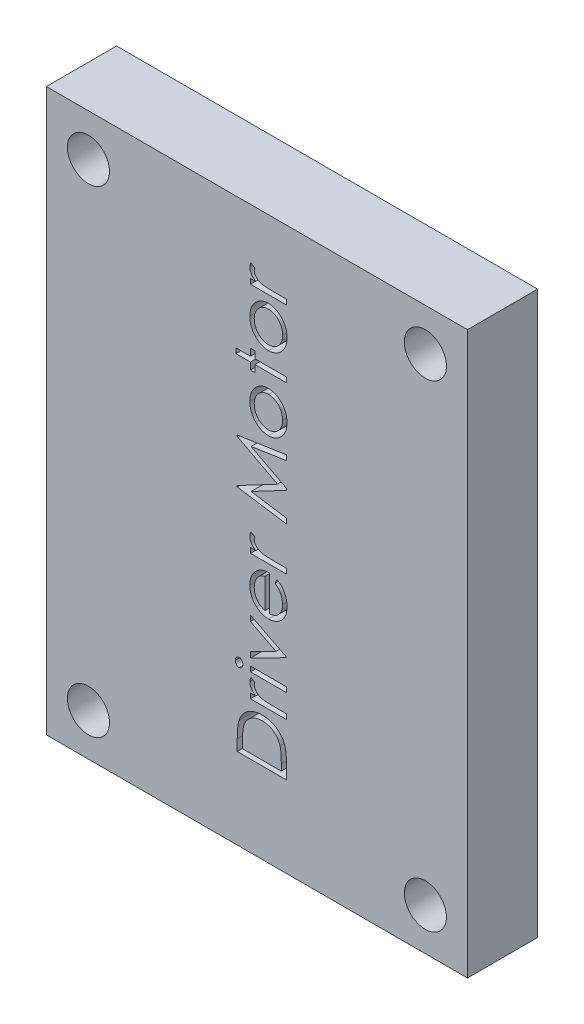
from build123d import *

# Parameters (mm, degrees)
ESQUISSE1_W             = 30
ESQUISSE1_H             = 40
EXTRUSION1_DEPTH        = 5
ESQUISSE2_W             = 2.557692308
ESQUISSE2_H             = 0.358974359
ENL_V_MAT_EXTRU_1_DEPTH = 2
ESQUISSE3_R             = 1.5
ENL_V_MAT_EXTRU_2_DEPTH = 8


with BuildPart() as part:
    # Esquisse1 → Extrusion1 (new body)
    with BuildSketch(Plane.XY):
        with Locations((-15, 20)):
            Rectangle(ESQUISSE1_W, ESQUISSE1_H)
    extrude(amount=EXTRUSION1_DEPTH)

    # Esquisse2 → Enlèv. mat.-Extru.1 (cut)
    # profile 1 of 12: a face of its own
    with BuildSketch(Plane.XY.offset(5)):
        with BuildLine():
            Line((-12.902097902, 5.772338772), (-16.402097902, 5.772338772))
            Line((-16.402097902, 5.772338772), (-16.402097902, 6.545676112))
            add(Edge.make_bspline(
                [(-16.402097902, 6.545676112), (-16.401656108, 6.612987478), (-16.400803038, 6.74296031), (-16.395379452, 6.930692141), (-16.385809041, 7.104193505), (-16.371780873, 7.263169427), (-16.354697847, 7.408027973), (-16.333195156, 7.538388127), (-16.307858741, 7.654644343), (-16.286139973, 7.726246699), (-16.275895979, 7.760019061)],
                knots=[0, 0, 0, 0, 1.318491949, 2.545901884, 3.678445365, 4.721642567, 5.671598565, 6.534823525, 7.308926774, 8, 8, 8, 8], degree=3))
            add(Edge.make_bspline(
                [(-16.275895979, 7.760019061), (-16.260459267, 7.80422512), (-16.229948056, 7.891599968), (-16.17272633, 8.016492431), (-16.107581186, 8.134124478), (-16.033451346, 8.243774374), (-15.952137973, 8.346445741), (-15.862505794, 8.441894398), (-15.764214035, 8.529329492), (-15.65830616, 8.60940729), (-15.54554016, 8.680542462), (-15.427436072, 8.74347772), (-15.303731586, 8.796020344), (-15.174696717, 8.838806109), (-15.040469539, 8.872658689), (-14.90074175, 8.896229135), (-14.755926812, 8.910463888), (-14.657739296, 8.912388187), (-14.607927229, 8.913364413)],
                knots=[0, 0, 0, 0, 1.03109956, 2.038004968, 3.022183136, 3.990379863, 4.950479215, 5.904790362, 6.871123431, 7.845270789, 8.826576108, 9.805447093, 10.790473371, 11.783660713, 12.797649702, 13.837096931, 14.902725355, 16, 16, 16, 16], degree=3))
            add(Edge.make_bspline(
                [(-14.607927229, 8.913364413), (-14.564660425, 8.912837926), (-14.47935704, 8.911799922), (-14.353652784, 8.899183842), (-14.23192668, 8.880312897), (-14.113849107, 8.854841807), (-13.999858263, 8.820102242), (-13.88984192, 8.777977415), (-13.78344577, 8.729034272), (-13.682264675, 8.671922173), (-13.585709979, 8.610091954), (-13.495564454, 8.542500347), (-13.412405212, 8.470096275), (-13.334311013, 8.394269346), (-13.26399848, 8.312984237), (-13.199605963, 8.227617645), (-13.141873115, 8.137774685), (-13.091109647, 8.041968675), (-13.045625918, 7.93960376), (-13.007269223, 7.827840497), (-12.974443614, 7.706760419), (-12.948183208, 7.575763501), (-12.927024454, 7.435399529), (-12.912890228, 7.285123066), (-12.903371034, 7.125159817), (-12.902530418, 7.015209003), (-12.902097902, 6.958636849)],
                knots=[0, 0, 0, 0, 1.054918746, 2.079842537, 3.077911686, 4.058492111, 5.023238441, 5.981293042, 6.930009524, 7.876754672, 8.812782874, 9.724811993, 10.621934444, 11.500650362, 12.377385791, 13.240394098, 14.10689676, 14.979024605, 15.882480973, 16.83611648, 17.857992353, 18.940126528, 20.092916994, 21.318615187, 22.620367535, 24, 24, 24, 24], degree=3))
            Line((-12.902097902, 6.958636849), (-12.902097902, 5.772338772))
        make_face()
        with BuildLine():
            Line((-13.261072261, 6.131313131), (-13.261072261, 6.565307522))
            add(Edge.make_bspline(
                [(-13.261072261, 6.565307522), (-13.261320821, 6.627709783), (-13.261798452, 6.747621747), (-13.265968691, 6.919898303), (-13.272871921, 7.07745616), (-13.282354499, 7.220094338), (-13.295025627, 7.347733672), (-13.30929795, 7.460575796), (-13.326727963, 7.558599252), (-13.342736088, 7.618244065), (-13.350114729, 7.645736208)],
                knots=[0, 0, 0, 0, 1.377932993, 2.64783117, 3.804968788, 4.860218214, 5.80403942, 6.636825548, 7.371670635, 8, 8, 8, 8], degree=3))
            add(Edge.make_bspline(
                [(-13.350114729, 7.645736208), (-13.361345195, 7.680250608), (-13.383469415, 7.748244597), (-13.42412104, 7.846295386), (-13.472222024, 7.938014285), (-13.525092097, 8.024998267), (-13.586221852, 8.105084148), (-13.652486699, 8.180154587), (-13.725533766, 8.249479138), (-13.804251649, 8.3128753), (-13.888488656, 8.369990696), (-13.978096839, 8.419081513), (-14.072059408, 8.461197397), (-14.170468628, 8.495826178), (-14.273626761, 8.521520667), (-14.381167101, 8.540262334), (-14.493347945, 8.552832649), (-14.56979825, 8.553865471), (-14.608628351, 8.554390054)],
                knots=[0, 0, 0, 0, 1.039856125, 2.048535285, 3.037002883, 4.00530023, 4.961642974, 5.919906605, 6.872042732, 7.843692398, 8.813285808, 9.784450683, 10.76770926, 11.761065139, 12.769744298, 13.810225642, 14.887785225, 16, 16, 16, 16], degree=3))
            add(Edge.make_bspline(
                [(-14.608628351, 8.554390054), (-14.649551403, 8.553526159), (-14.729938021, 8.551829177), (-14.848184486, 8.540125194), (-14.961518376, 8.518734132), (-15.070475296, 8.489935986), (-15.175501003, 8.45395534), (-15.27519799, 8.407632058), (-15.371049436, 8.354635654), (-15.461224704, 8.292624274), (-15.546327507, 8.224196942), (-15.624269217, 8.148169159), (-15.695241912, 8.065602233), (-15.760180143, 7.977395185), (-15.816756848, 7.881880116), (-15.867807311, 7.780802222), (-15.910401721, 7.672361029), (-15.933321199, 7.597058178), (-15.944966492, 7.558797106)],
                knots=[0, 0, 0, 0, 1.089998388, 2.141122879, 3.160582858, 4.158627459, 5.140999449, 6.113141423, 7.082948792, 8.055011043, 9.024278859, 9.98833552, 10.950481064, 11.921645981, 12.901668197, 13.903858501, 14.93495903, 16, 16, 16, 16], degree=3))
            add(Edge.make_bspline(
                [(-15.944966492, 7.558797106), (-15.953091171, 7.527103365), (-15.970417258, 7.459515651), (-15.989120715, 7.349503315), (-16.00581549, 7.225561123), (-16.019802353, 7.087374239), (-16.029934862, 6.93489675), (-16.037475102, 6.768225447), (-16.042593234, 6.587307664), (-16.04294245, 6.462012678), (-16.043123543, 6.397038292)],
                knots=[0, 0, 0, 0, 0.671630374, 1.43226897, 2.289500064, 3.239801583, 4.283712342, 5.427140445, 6.66578882, 8, 8, 8, 8], degree=3))
            Line((-16.043123543, 6.397038292), (-16.043123543, 6.131313131))
            Line((-16.043123543, 6.131313131), (-13.261072261, 6.131313131))
        make_face(mode=Mode.SUBTRACT)
    # profile 2 of 12: a face of its own
    with BuildSketch(Plane.XY.offset(5)):
        with BuildLine():
            Line((-15.45979021, 9.496697747), (-15.45979021, 9.855672106))
            Line((-15.45979021, 9.855672106), (-15.083287806, 9.855672106))
            add(Edge.make_bspline(
                [(-15.083287806, 9.855672106), (-15.118385216, 9.881201059), (-15.185741338, 9.93019417), (-15.274868065, 10.011234171), (-15.348324495, 10.094718562), (-15.406861233, 10.18042667), (-15.450801501, 10.268331559), (-15.481881348, 10.35787403), (-15.500894177, 10.449424748), (-15.503403804, 10.511132952), (-15.504662005, 10.542070343)],
                knots=[0, 0, 0, 0, 1.240090001, 2.379880825, 3.435825918, 4.412439249, 5.338731203, 6.236759833, 7.116000016, 8, 8, 8, 8], degree=3))
            add(Edge.make_bspline(
                [(-15.504662005, 10.542070343), (-15.503464336, 10.565990505), (-15.50099697, 10.615269439), (-15.483918986, 10.689996016), (-15.456529453, 10.767057654), (-15.430515759, 10.816963918), (-15.41702178, 10.842851593)],
                knots=[0, 0, 0, 0, 0.906785846, 1.868107758, 2.894132143, 4, 4, 4, 4], degree=3))
            Line((-15.41702178, 10.842851593), (-15.144986524, 10.655652074))
            add(Edge.make_bspline(
                [(-15.144986524, 10.655652074), (-15.151720046, 10.638897443), (-15.16449045, 10.607121589), (-15.179763804, 10.560751378), (-15.188559994, 10.518099649), (-15.189924319, 10.490920638), (-15.190559441, 10.47826826)],
                knots=[0, 0, 0, 0, 1.175706723, 2.229776724, 3.175925307, 4, 4, 4, 4], degree=3))
            add(Edge.make_bspline(
                [(-15.190559441, 10.47826826), (-15.188906274, 10.450500016), (-15.185546911, 10.394072801), (-15.158539935, 10.311215918), (-15.116436175, 10.229800735), (-15.067517162, 10.165956602), (-15.021258441, 10.116025177), (-14.979750811, 10.081136701), (-14.934840231, 10.047264877), (-14.884146785, 10.017592566), (-14.83020237, 9.988072235), (-14.770472733, 9.962862403), (-14.706685693, 9.938763003), (-14.662229579, 9.925076474), (-14.63947771, 9.918071945)],
                knots=[0, 0, 0, 0, 1.183164879, 2.404282402, 3.684748724, 5.08130077, 5.822236575, 6.586118212, 7.392150472, 8.220166419, 9.090371106, 10.015126268, 10.984176003, 12, 12, 12, 12], degree=3))
            add(Edge.make_bspline(
                [(-14.63947771, 9.918071945), (-14.619209963, 9.912860351), (-14.574147304, 9.901273058), (-14.498775917, 9.889673791), (-14.409659452, 9.879301238), (-14.307049868, 9.870034959), (-14.190095992, 9.864333236), (-14.05967858, 9.859517499), (-13.915241141, 9.855617649), (-13.814493976, 9.855653375), (-13.761673223, 9.855672106)],
                knots=[0, 0, 0, 0, 0.569198417, 1.265537535, 2.072538121, 3.011085978, 4.068372936, 5.258499352, 6.562658, 8, 8, 8, 8], degree=3))
            Line((-13.761673223, 9.855672106), (-12.902097902, 9.855672106))
            Line((-12.902097902, 9.855672106), (-12.902097902, 9.496697747))
            Line((-12.902097902, 9.496697747), (-15.45979021, 9.496697747))
        make_face()
    # profile 3 of 12: a face of its own
    with BuildSketch(Plane.XY.offset(5)):
        with BuildLine():
            add(Edge.make_bspline(
                [(-16.536713287, 11.335039093), (-16.535814731, 11.356157736), (-16.53406397, 11.397305681), (-16.519062593, 11.456696549), (-16.493239576, 11.510613355), (-16.458996631, 11.558628922), (-16.418454057, 11.599726284), (-16.371169809, 11.628702912), (-16.320066766, 11.647719112), (-16.284243261, 11.64959354), (-16.266080274, 11.650543901)],
                knots=[0, 0, 0, 0, 1.097978545, 2.139321259, 3.162173311, 4.19151332, 5.197815518, 6.142860071, 7.058405672, 8, 8, 8, 8], degree=3))
            add(Edge.make_bspline(
                [(-16.266080274, 11.650543901), (-16.248388248, 11.649567479), (-16.213261071, 11.647628812), (-16.163042103, 11.62871047), (-16.116432734, 11.599491456), (-16.075950842, 11.55865518), (-16.041730171, 11.51060631), (-16.015901165, 11.456698457), (-16.000901407, 11.39730517), (-15.99915042, 11.356157562), (-15.998251748, 11.335039093)],
                knots=[0, 0, 0, 0, 0.922703544, 1.832010186, 2.772146749, 3.784264281, 4.819552758, 5.848315786, 6.89567633, 8, 8, 8, 8], degree=3))
            add(Edge.make_bspline(
                [(-15.998251748, 11.335039093), (-15.999133795, 11.314379521), (-16.000851926, 11.274136913), (-16.016188716, 11.215795576), (-16.041705596, 11.162270406), (-16.075957296, 11.114229058), (-16.116431155, 11.073390834), (-16.163042496, 11.044172298), (-16.213260972, 11.025253837), (-16.248388215, 11.023315186), (-16.266080274, 11.022338772)],
                knots=[0, 0, 0, 0, 1.086463775, 2.116313756, 3.151298715, 4.192848589, 5.211087382, 6.156909866, 7.071715969, 8, 8, 8, 8], degree=3))
            add(Edge.make_bspline(
                [(-16.266080274, 11.022338772), (-16.284243296, 11.023289124), (-16.320066868, 11.025163537), (-16.371169409, 11.044179858), (-16.418455655, 11.073156002), (-16.458990178, 11.114255316), (-16.493264154, 11.162263354), (-16.518775074, 11.215797437), (-16.53411344, 11.274136419), (-16.535831352, 11.314379353), (-16.536713287, 11.335039093)],
                knots=[0, 0, 0, 0, 0.947256149, 1.868306938, 2.819034057, 3.831387165, 4.86691661, 5.895919087, 6.919816268, 8, 8, 8, 8], degree=3))
        make_face()
    # profile 4 of 12: a face of its own
    with BuildSketch(Plane.XY.offset(5)):
        with Locations((-14.180944056, 11.336441337)):
            Rectangle(ESQUISSE2_W, ESQUISSE2_H)
    # profile 5 of 12: a face of its own
    with BuildSketch(Plane.XY.offset(5)):
        Polygon((-15.45979021, 12.00951826), (-15.45979021, 12.406353195), (-13.637574665, 13.33393733), (-15.45979021, 14.260119221), (-15.45979021, 14.656954157), (-12.902097902, 13.355672106), (-12.902097902, 13.310800311), align=None)
    # profile 6 of 12: a face of its own
    with BuildSketch(Plane.XY.offset(5)):
        with BuildLine():
            Line((-13.70979021, 17.495796304), (-13.563255755, 17.797979798))
            add(Edge.make_bspline(
                [(-13.563255755, 17.797979798), (-13.523717481, 17.773479033), (-13.446359663, 17.725542551), (-13.341431214, 17.642741642), (-13.246890758, 17.555876573), (-13.165433554, 17.461541662), (-13.093350727, 17.362473318), (-13.031547364, 17.256995228), (-12.977773836, 17.14614058), (-12.934492278, 17.028350135), (-12.899975546, 16.904095052), (-12.874578352, 16.772402818), (-12.859937239, 16.632582055), (-12.858144403, 16.536696175), (-12.857226107, 16.487583163)],
                knots=[0, 0, 0, 0, 1.069570816, 2.092647344, 3.070569067, 4.01967349, 4.95558248, 5.886223065, 6.829136365, 7.787158173, 8.769682878, 9.793833117, 10.86999526, 12, 12, 12, 12], degree=3))
            add(Edge.make_bspline(
                [(-12.857226107, 16.487583163), (-12.858355988, 16.433069067), (-12.860555103, 16.326966929), (-12.880007871, 16.172344769), (-12.911002951, 16.026876038), (-12.955556286, 15.890408962), (-13.012089363, 15.762923892), (-13.082388469, 15.644884658), (-13.164393611, 15.535523591), (-13.259256009, 15.437531251), (-13.36130213, 15.349973357), (-13.466929484, 15.272058257), (-13.577067727, 15.207677693), (-13.689779887, 15.153478007), (-13.806235341, 15.112285446), (-13.925988713, 15.082766341), (-14.048747968, 15.063615254), (-14.132028539, 15.061742583), (-14.173932838, 15.060800311)],
                knots=[0, 0, 0, 0, 1.205476757, 2.346249306, 3.441406768, 4.491003892, 5.516176455, 6.51984946, 7.52384197, 8.53303875, 9.530058913, 10.495883174, 11.432185487, 12.347937671, 13.258729326, 14.159013425, 15.073670464, 16, 16, 16, 16], degree=3))
            add(Edge.make_bspline(
                [(-14.173932838, 15.060800311), (-14.213250113, 15.061661851), (-14.291258766, 15.063371217), (-14.406429852, 15.079530548), (-14.518728895, 15.104510617), (-14.627502264, 15.140629995), (-14.733361704, 15.186136051), (-14.835180062, 15.243051897), (-14.934824897, 15.308554135), (-14.996585215, 15.36002424), (-15.027899184, 15.386120824)],
                knots=[0, 0, 0, 0, 1.009393624, 2.002718548, 2.981368972, 3.96092115, 4.942292709, 5.936433579, 6.953722102, 8, 8, 8, 8], degree=3))
            add(Edge.make_bspline(
                [(-15.027899184, 15.386120824), (-15.065894525, 15.421057633), (-15.140928548, 15.490051599), (-15.238080685, 15.607061837), (-15.320768429, 15.732559213), (-15.388421509, 15.867112263), (-15.440370322, 16.010537372), (-15.477439414, 16.162371088), (-15.50031742, 16.322826832), (-15.503193399, 16.432818591), (-15.504662005, 16.488985407)],
                knots=[0, 0, 0, 0, 0.997027178, 1.968950865, 2.931417886, 3.897315191, 4.873598335, 5.874141366, 6.914439499, 8, 8, 8, 8], degree=3))
            add(Edge.make_bspline(
                [(-15.504662005, 16.488985407), (-15.503316152, 16.546801876), (-15.50067778, 16.660143625), (-15.475999728, 16.825483776), (-15.437339428, 16.982309424), (-15.381193875, 17.129434337), (-15.311243898, 17.268527668), (-15.222924733, 17.397087153), (-15.120735915, 17.518308081), (-15.041418315, 17.589471084), (-15.001256556, 17.625503836)],
                knots=[0, 0, 0, 0, 1.078704368, 2.114661124, 3.113565113, 4.088377923, 5.048374518, 6.012812246, 6.993805198, 8, 8, 8, 8], degree=3))
            add(Edge.make_bspline(
                [(-15.001256556, 17.625503836), (-14.971065715, 17.649686965), (-14.911002384, 17.697798221), (-14.813245302, 17.759718894), (-14.71023322, 17.812369237), (-14.601439801, 17.855246842), (-14.487405531, 17.888982005), (-14.367768757, 17.913270093), (-14.242600787, 17.929270077), (-14.157155727, 17.931473117), (-14.113636364, 17.932595183)],
                knots=[0, 0, 0, 0, 0.967473567, 1.924745518, 2.889953502, 3.858752097, 4.846970718, 5.862117206, 6.911121386, 8, 8, 8, 8], degree=3))
            Line((-14.113636364, 17.932595183), (-14.113636364, 15.41977467))
            add(Edge.make_bspline(
                [(-14.113636364, 15.41977467), (-14.07993253, 15.421519361), (-14.013599904, 15.424953094), (-13.9164045, 15.440204421), (-13.8242357, 15.465796277), (-13.736782614, 15.499462949), (-13.653993167, 15.541895321), (-13.575826406, 15.593224971), (-13.502560053, 15.654199611), (-13.434475016, 15.723007189), (-13.37285665, 15.798711609), (-13.318954012, 15.879266324), (-13.272748155, 15.964055202), (-13.23568408, 16.053418364), (-13.20675572, 16.147083802), (-13.186732052, 16.245260095), (-13.173626859, 16.347473005), (-13.172101577, 16.417196253), (-13.171328671, 16.452527074)],
                knots=[0, 0, 0, 0, 1.039073669, 2.045004336, 3.02296125, 3.980111893, 4.926619486, 5.882957722, 6.854402205, 7.857159866, 8.859995037, 9.85624635, 10.83864398, 11.829261994, 12.831114931, 13.853244543, 14.912175862, 16, 16, 16, 16], degree=3))
            add(Edge.make_bspline(
                [(-13.171328671, 16.452527074), (-13.171955179, 16.48714568), (-13.173207279, 16.556332337), (-13.184789305, 16.659233202), (-13.203636298, 16.760744844), (-13.230469627, 16.859395566), (-13.262061876, 16.953957854), (-13.299150804, 17.041968311), (-13.341426078, 17.122383892), (-13.389530688, 17.197756028), (-13.448361388, 17.270742481), (-13.521395633, 17.344108247), (-13.609339909, 17.420630103), (-13.675086186, 17.469827546), (-13.70979021, 17.495796304)],
                knots=[0, 0, 0, 0, 1.015927462, 2.030371344, 3.035493238, 4.043957638, 5.028905753, 5.960363326, 6.844165366, 7.692896148, 8.581107265, 9.590178204, 10.727981024, 12, 12, 12, 12], degree=3))
        make_face()
        with BuildLine():
            add(Edge.make_bspline(
                [(-14.427738928, 17.573620824), (-14.469437539, 17.560982139), (-14.549619428, 17.536679323), (-14.660766036, 17.486598255), (-14.759660157, 17.429911211), (-14.845549617, 17.36234723), (-14.920786534, 17.285628528), (-14.987380195, 17.197730412), (-15.04670941, 17.099075733), (-15.097345039, 16.99015665), (-15.138276146, 16.874624975), (-15.168988473, 16.754842552), (-15.186585871, 16.6316019), (-15.189228856, 16.548400419), (-15.190559441, 16.506513452)],
                knots=[0, 0, 0, 0, 1.104651615, 2.124124779, 3.086357996, 3.990392669, 4.887867225, 5.805973849, 6.782394871, 7.803867138, 8.848693862, 9.888661684, 10.937067484, 12, 12, 12, 12], degree=3))
            add(Edge.make_bspline(
                [(-15.190559441, 16.506513452), (-15.189949634, 16.47236086), (-15.188743324, 16.404800756), (-15.177251811, 16.305369683), (-15.158561192, 16.209607133), (-15.13141964, 16.117847098), (-15.097996773, 16.029558218), (-15.057162237, 15.944605795), (-15.007954635, 15.863826828), (-14.969900343, 15.813270959), (-14.950775787, 15.787863612)],
                knots=[0, 0, 0, 0, 1.060669213, 2.098198702, 3.104911882, 4.088287873, 5.067258181, 6.03496313, 7.012451476, 8, 8, 8, 8], degree=3))
            add(Edge.make_bspline(
                [(-14.950775787, 15.787863612), (-14.935703459, 15.769772565), (-14.90527511, 15.733249961), (-14.852569673, 15.683943529), (-14.796050884, 15.636125758), (-14.732277648, 15.594084667), (-14.664312322, 15.553550475), (-14.590324915, 15.517708511), (-14.51171774, 15.483135547), (-14.456193183, 15.464884738), (-14.427738928, 15.455531881)],
                knots=[0, 0, 0, 0, 0.898062514, 1.813028429, 2.750892972, 3.72092503, 4.724711932, 5.770102147, 6.857260878, 8, 8, 8, 8], degree=3))
            Line((-14.427738928, 15.455531881), (-14.427738928, 17.573620824))
        make_face(mode=Mode.SUBTRACT)
    # profile 7 of 12: a face of its own
    with BuildSketch(Plane.XY.offset(5)):
        with BuildLine():
            Line((-15.45979021, 18.471056721), (-15.45979021, 18.83003108))
            Line((-15.45979021, 18.83003108), (-15.083287806, 18.83003108))
            add(Edge.make_bspline(
                [(-15.083287806, 18.83003108), (-15.118385216, 18.855560033), (-15.185741338, 18.904553144), (-15.274868065, 18.985593146), (-15.348324495, 19.069077536), (-15.406861233, 19.154785644), (-15.450801501, 19.242690533), (-15.481881348, 19.332233004), (-15.500894177, 19.423783723), (-15.503403804, 19.485491926), (-15.504662005, 19.516429317)],
                knots=[0, 0, 0, 0, 1.240090001, 2.379880825, 3.435825918, 4.412439249, 5.338731203, 6.236759833, 7.116000016, 8, 8, 8, 8], degree=3))
            add(Edge.make_bspline(
                [(-15.504662005, 19.516429317), (-15.503464336, 19.540349479), (-15.50099697, 19.589628414), (-15.483918986, 19.664354991), (-15.456529453, 19.741416628), (-15.430515759, 19.791322892), (-15.41702178, 19.817210567)],
                knots=[0, 0, 0, 0, 0.906785846, 1.868107758, 2.894132143, 4, 4, 4, 4], degree=3))
            Line((-15.41702178, 19.817210567), (-15.144986524, 19.630011048))
            add(Edge.make_bspline(
                [(-15.144986524, 19.630011048), (-15.151720046, 19.613256417), (-15.16449045, 19.581480563), (-15.179763804, 19.535110353), (-15.188559994, 19.492458623), (-15.189924319, 19.465279612), (-15.190559441, 19.452627234)],
                knots=[0, 0, 0, 0, 1.175706723, 2.229776724, 3.175925307, 4, 4, 4, 4], degree=3))
            add(Edge.make_bspline(
                [(-15.190559441, 19.452627234), (-15.188906274, 19.42485899), (-15.185546911, 19.368431775), (-15.158539935, 19.285574892), (-15.116436175, 19.204159709), (-15.067517162, 19.140315576), (-15.021258441, 19.090384151), (-14.979750811, 19.055495676), (-14.934840231, 19.021623851), (-14.884146785, 18.99195154), (-14.83020237, 18.96243121), (-14.770472733, 18.937221378), (-14.706685693, 18.913121977), (-14.662229579, 18.899435448), (-14.63947771, 18.89243092)],
                knots=[0, 0, 0, 0, 1.183164879, 2.404282402, 3.684748724, 5.08130077, 5.822236575, 6.586118212, 7.392150472, 8.220166419, 9.090371106, 10.015126268, 10.984176003, 12, 12, 12, 12], degree=3))
            add(Edge.make_bspline(
                [(-14.63947771, 18.89243092), (-14.619209963, 18.887219325), (-14.574147304, 18.875632033), (-14.498775917, 18.864032765), (-14.409659452, 18.853660213), (-14.307049868, 18.844393934), (-14.190095992, 18.83869221), (-14.05967858, 18.833876473), (-13.915241141, 18.829976624), (-13.814493976, 18.830012349), (-13.761673223, 18.83003108)],
                knots=[0, 0, 0, 0, 0.569198417, 1.265537535, 2.072538121, 3.011085978, 4.068372936, 5.258499352, 6.562658, 8, 8, 8, 8], degree=3))
            Line((-13.761673223, 18.83003108), (-12.902097902, 18.83003108))
            Line((-12.902097902, 18.83003108), (-12.902097902, 18.471056721))
            Line((-12.902097902, 18.471056721), (-15.45979021, 18.471056721))
        make_face()
    # profile 8 of 12: a face of its own
    with BuildSketch(Plane.XY.offset(5)):
        Polygon((-12.902097902, 21.567210567), (-16.402097902, 22.093753035), (-16.402097902, 22.18139326), (-13.53030303, 23.698620824), (-16.402097902, 25.213745022), (-16.402097902, 25.302086368), (-12.902097902, 25.83003108), (-12.902097902, 25.468953356), (-15.414918415, 25.089646465), (-12.902097902, 23.764526272), (-12.902097902, 23.635519862), (-15.414918415, 22.307595183), (-12.902097902, 21.929690535), align=None)
    # profile 9 of 12: a face of its own
    with BuildSketch(Plane.XY.offset(5)):
        with BuildLine():
            add(Edge.make_bspline(
                [(-15.504662005, 27.828228195), (-15.503613039, 27.880882736), (-15.501548844, 27.984498431), (-15.480441892, 28.136087503), (-15.447482307, 28.280868956), (-15.402239411, 28.419144327), (-15.342049672, 28.549977063), (-15.269242519, 28.674156643), (-15.184085394, 28.79217817), (-15.117072413, 28.863090641), (-15.083287806, 28.898841176)],
                knots=[0, 0, 0, 0, 1.068815322, 2.103257178, 3.101534262, 4.081671039, 5.052337897, 6.020262096, 7.001914763, 8, 8, 8, 8], degree=3))
            add(Edge.make_bspline(
                [(-15.083287806, 28.898841176), (-15.05116071, 28.92967225), (-14.987845736, 28.990433067), (-14.884089126, 29.068465776), (-14.777233058, 29.136288271), (-14.664704555, 29.190164732), (-14.548426463, 29.233296525), (-14.427382569, 29.26364062), (-14.302058936, 29.281257712), (-14.216990019, 29.283848149), (-14.173932838, 29.285159285)],
                knots=[0, 0, 0, 0, 1.051605614, 2.072468086, 3.062619048, 4.038506411, 5.015440704, 5.989450154, 6.982370862, 8, 8, 8, 8], degree=3))
            add(Edge.make_bspline(
                [(-14.173932838, 29.285159285), (-14.130633029, 29.283955004), (-14.045013853, 29.281573711), (-13.918663092, 29.262327716), (-13.796784777, 29.229430681), (-13.678315445, 29.185769337), (-13.564874277, 29.127113279), (-13.454869441, 29.057225961), (-13.350555793, 28.972520161), (-13.249907705, 28.87831334), (-13.157971369, 28.773334688), (-13.077700132, 28.65968855), (-13.008948034, 28.539246104), (-12.953792387, 28.410879454), (-12.909855121, 28.275542612), (-12.87937133, 28.132696325), (-12.860847005, 27.982730039), (-12.858448779, 27.880398963), (-12.857226107, 27.828228195)],
                knots=[0, 0, 0, 0, 0.949994267, 1.878477709, 2.796632871, 3.716905844, 4.64361676, 5.594026313, 6.572073535, 7.587985714, 8.616674413, 9.628499912, 10.636848494, 11.654481232, 12.689327471, 13.754699228, 14.85529333, 16, 16, 16, 16], degree=3))
            add(Edge.make_bspline(
                [(-12.857226107, 27.828228195), (-12.858455266, 27.775825493), (-12.860866393, 27.673032009), (-12.879274626, 27.522573501), (-12.910000326, 27.37932619), (-12.953603957, 27.243638706), (-13.009163441, 27.11499115), (-13.077473547, 26.994069825), (-13.158000427, 26.880332099), (-13.249902636, 26.775340198), (-13.350547412, 26.681111053), (-13.454905745, 26.596502792), (-13.564653419, 26.526319432), (-13.678675468, 26.468936253), (-13.796594412, 26.423968759), (-13.918692849, 26.39139799), (-14.045006176, 26.372059154), (-14.130630451, 26.369690505), (-14.173932838, 26.368492618)],
                knots=[0, 0, 0, 0, 1.148463466, 2.252833429, 3.316937588, 4.355428806, 5.371850748, 6.383458687, 7.394080299, 8.421545047, 9.436248477, 10.413132002, 11.362410741, 12.285705319, 13.206694609, 14.123757336, 15.051136053, 16, 16, 16, 16], degree=3))
            add(Edge.make_bspline(
                [(-14.173932838, 26.368492618), (-14.21675713, 26.369809074), (-14.301593703, 26.372417023), (-14.426665199, 26.390057219), (-14.54735872, 26.420078415), (-14.662966065, 26.463792404), (-14.775226802, 26.517557224), (-14.882530279, 26.584743572), (-14.985771723, 26.663488857), (-15.049022046, 26.724027304), (-15.081184441, 26.754810727)],
                knots=[0, 0, 0, 0, 1.014086669, 2.008944818, 2.984854809, 3.953312651, 4.931104218, 5.927885007, 6.946342435, 8, 8, 8, 8], degree=3))
            add(Edge.make_bspline(
                [(-15.081184441, 26.754810727), (-15.115261797, 26.790515104), (-15.182748713, 26.861224177), (-15.267647635, 26.979746228), (-15.341755882, 27.103571718), (-15.401103728, 27.235232578), (-15.447855603, 27.373518721), (-15.480345326, 27.519005878), (-15.501573334, 27.671250932), (-15.503621329, 27.775337322), (-15.504662005, 27.828228195)],
                knots=[0, 0, 0, 0, 0.998093635, 1.976628122, 2.943876161, 3.915765078, 4.894288126, 5.894006546, 6.929852073, 8, 8, 8, 8], degree=3))
        make_face()
        with BuildLine():
            add(Edge.make_bspline(
                [(-15.190559441, 27.826825952), (-15.189600726, 27.789854149), (-15.187712667, 27.717043119), (-15.173220014, 27.609807786), (-15.15021711, 27.50652724), (-15.118049944, 27.407000186), (-15.075406021, 27.311921794), (-15.024213149, 27.22049891), (-14.963357377, 27.132969005), (-14.894075079, 27.050654313), (-14.81818075, 26.975126823), (-14.737251914, 26.909169546), (-14.653111283, 26.852065085), (-14.563770593, 26.807620375), (-14.471627235, 26.770943195), (-14.37500001, 26.746248839), (-14.274747969, 26.729944084), (-14.206484241, 26.72830107), (-14.171829473, 26.727466977)],
                knots=[0, 0, 0, 0, 1.065370108, 2.098104178, 3.112976507, 4.112054385, 5.107218579, 6.111551222, 7.128076548, 8.175144984, 9.208779404, 10.209309629, 11.180824121, 12.132805369, 13.079768484, 14.033963618, 15.001921836, 16, 16, 16, 16], degree=3))
            add(Edge.make_bspline(
                [(-14.171829473, 26.727466977), (-14.127039213, 26.729129659), (-14.037965682, 26.732436202), (-13.907181932, 26.761849168), (-13.781205491, 26.808429851), (-13.661594997, 26.872938842), (-13.551334472, 26.953484268), (-13.452220379, 27.047029564), (-13.367214049, 27.154335143), (-13.296785277, 27.273643956), (-13.240653369, 27.402479313), (-13.201078347, 27.538704516), (-13.175164816, 27.68070975), (-13.172620209, 27.777632141), (-13.171328671, 27.826825952)],
                knots=[0, 0, 0, 0, 0.973405266, 1.935792384, 2.901063015, 3.888379013, 4.882011643, 5.863865997, 6.844561104, 7.849988313, 8.870157053, 9.893387583, 10.930770379, 12, 12, 12, 12], degree=3))
            add(Edge.make_bspline(
                [(-13.171328671, 27.826825952), (-13.172618003, 27.87602063), (-13.175158263, 27.972944732), (-13.201103508, 28.114937488), (-13.240500781, 28.251002975), (-13.296942919, 28.379483958), (-13.367419797, 28.498677248), (-13.451974529, 28.606586736), (-13.551364913, 28.70014308), (-13.661586852, 28.780719633), (-13.781207613, 28.845220341), (-13.907181373, 28.891803186), (-14.037965824, 28.921215588), (-14.12703926, 28.924522207), (-14.171829473, 28.926184926)],
                knots=[0, 0, 0, 0, 1.069289782, 2.106730948, 3.130019052, 4.14558402, 5.151067801, 6.135804066, 7.117713665, 8.111402202, 9.098773753, 10.064098697, 11.026539965, 12, 12, 12, 12], degree=3))
            add(Edge.make_bspline(
                [(-14.171829473, 28.926184926), (-14.206483603, 28.925349575), (-14.274746074, 28.923704083), (-14.375007281, 28.907417404), (-14.47160046, 28.882655907), (-14.563969252, 28.846188347), (-14.652922677, 28.800742513), (-14.737251366, 28.743809256), (-14.818420395, 28.67782359), (-14.893837153, 28.601591742), (-14.963391395, 28.519314415), (-15.024205131, 28.431742127), (-15.075404956, 28.340329437), (-15.118061997, 28.245251661), (-15.15009928, 28.145929362), (-15.173313118, 28.042930438), (-15.187663754, 27.936135978), (-15.189586273, 27.863562291), (-15.190559441, 27.826825952)],
                knots=[0, 0, 0, 0, 0.998420087, 1.966709908, 2.921231931, 3.868519457, 4.823897383, 5.795744697, 6.796617685, 7.835360103, 8.882787245, 9.899660812, 10.904337521, 11.899842639, 12.899262782, 13.907908955, 14.94099682, 16, 16, 16, 16], degree=3))
        make_face(mode=Mode.SUBTRACT)
    # profile 10 of 12: a face of its own
    with BuildSketch(Plane.XY.offset(5)):
        Polygon((-16.491841492, 30.272338772), (-16.491841492, 30.631313131), (-15.45979021, 30.631313131), (-15.45979021, 31.124902875), (-15.145687646, 31.124902875), (-15.145687646, 30.631313131), (-12.902097902, 30.631313131), (-12.902097902, 30.272338772), (-15.145687646, 30.272338772), (-15.145687646, 29.778749029), (-15.45979021, 29.778749029), (-15.45979021, 30.272338772), align=None)
    # profile 11 of 12: a face of its own
    with BuildSketch(Plane.XY.offset(5)):
        with BuildLine():
            add(Edge.make_bspline(
                [(-15.504662005, 33.078228195), (-15.503613039, 33.130882736), (-15.501548844, 33.234498431), (-15.480441892, 33.386087503), (-15.447482307, 33.530868956), (-15.402239411, 33.669144327), (-15.342049672, 33.799977063), (-15.269242519, 33.924156643), (-15.184085394, 34.04217817), (-15.117072413, 34.113090641), (-15.083287806, 34.148841176)],
                knots=[0, 0, 0, 0, 1.068815322, 2.103257178, 3.101534262, 4.081671039, 5.052337897, 6.020262096, 7.001914763, 8, 8, 8, 8], degree=3))
            add(Edge.make_bspline(
                [(-15.083287806, 34.148841176), (-15.05116071, 34.17967225), (-14.987845736, 34.240433067), (-14.884089126, 34.318465776), (-14.777233058, 34.386288271), (-14.664704555, 34.440164732), (-14.548426463, 34.483296525), (-14.427382569, 34.51364062), (-14.302058936, 34.531257712), (-14.216990019, 34.533848149), (-14.173932838, 34.535159285)],
                knots=[0, 0, 0, 0, 1.051605614, 2.072468086, 3.062619048, 4.038506411, 5.015440704, 5.989450154, 6.982370862, 8, 8, 8, 8], degree=3))
            add(Edge.make_bspline(
                [(-14.173932838, 34.535159285), (-14.130633029, 34.533955004), (-14.045013853, 34.531573711), (-13.918663092, 34.512327716), (-13.796784777, 34.479430681), (-13.678315445, 34.435769337), (-13.564874277, 34.377113279), (-13.454869441, 34.307225961), (-13.350555793, 34.222520161), (-13.249907705, 34.12831334), (-13.157971369, 34.023334688), (-13.077700132, 33.90968855), (-13.008948034, 33.789246104), (-12.953792387, 33.660879454), (-12.909855121, 33.525542612), (-12.87937133, 33.382696325), (-12.860847005, 33.232730039), (-12.858448779, 33.130398963), (-12.857226107, 33.078228195)],
                knots=[0, 0, 0, 0, 0.949994267, 1.878477709, 2.796632871, 3.716905844, 4.64361676, 5.594026313, 6.572073535, 7.587985714, 8.616674413, 9.628499912, 10.636848494, 11.654481232, 12.689327471, 13.754699228, 14.85529333, 16, 16, 16, 16], degree=3))
            add(Edge.make_bspline(
                [(-12.857226107, 33.078228195), (-12.858455266, 33.025825493), (-12.860866393, 32.923032009), (-12.879274626, 32.772573501), (-12.910000326, 32.62932619), (-12.953603957, 32.493638706), (-13.009163441, 32.36499115), (-13.077473547, 32.244069825), (-13.158000427, 32.130332099), (-13.249902636, 32.025340198), (-13.350547412, 31.931111053), (-13.454905745, 31.846502792), (-13.564653419, 31.776319432), (-13.678675468, 31.718936253), (-13.796594412, 31.673968759), (-13.918692849, 31.64139799), (-14.045006176, 31.622059154), (-14.130630451, 31.619690505), (-14.173932838, 31.618492618)],
                knots=[0, 0, 0, 0, 1.148463466, 2.252833429, 3.316937588, 4.355428806, 5.371850748, 6.383458687, 7.394080299, 8.421545047, 9.436248477, 10.413132002, 11.362410741, 12.285705319, 13.206694609, 14.123757336, 15.051136053, 16, 16, 16, 16], degree=3))
            add(Edge.make_bspline(
                [(-14.173932838, 31.618492618), (-14.21675713, 31.619809074), (-14.301593703, 31.622417023), (-14.426665199, 31.640057219), (-14.54735872, 31.670078415), (-14.662966065, 31.713792404), (-14.775226802, 31.767557224), (-14.882530279, 31.834743572), (-14.985771723, 31.913488857), (-15.049022046, 31.974027304), (-15.081184441, 32.004810727)],
                knots=[0, 0, 0, 0, 1.014086669, 2.008944818, 2.984854809, 3.953312651, 4.931104218, 5.927885007, 6.946342435, 8, 8, 8, 8], degree=3))
            add(Edge.make_bspline(
                [(-15.081184441, 32.004810727), (-15.115261797, 32.040515104), (-15.182748713, 32.111224177), (-15.267647635, 32.229746228), (-15.341755882, 32.353571718), (-15.401103728, 32.485232578), (-15.447855603, 32.623518721), (-15.480345326, 32.769005878), (-15.501573334, 32.921250932), (-15.503621329, 33.025337322), (-15.504662005, 33.078228195)],
                knots=[0, 0, 0, 0, 0.998093635, 1.976628122, 2.943876161, 3.915765078, 4.894288126, 5.894006546, 6.929852073, 8, 8, 8, 8], degree=3))
        make_face()
        with BuildLine():
            add(Edge.make_bspline(
                [(-15.190559441, 33.076825952), (-15.189600726, 33.039854149), (-15.187712667, 32.967043119), (-15.173220014, 32.859807786), (-15.15021711, 32.75652724), (-15.118049944, 32.657000186), (-15.075406021, 32.561921794), (-15.024213149, 32.47049891), (-14.963357377, 32.382969005), (-14.894075079, 32.300654313), (-14.81818075, 32.225126823), (-14.737251914, 32.159169546), (-14.653111283, 32.102065085), (-14.563770593, 32.057620375), (-14.471627235, 32.020943195), (-14.37500001, 31.996248839), (-14.274747969, 31.979944084), (-14.206484241, 31.97830107), (-14.171829473, 31.977466977)],
                knots=[0, 0, 0, 0, 1.065370108, 2.098104178, 3.112976507, 4.112054385, 5.107218579, 6.111551222, 7.128076548, 8.175144984, 9.208779404, 10.209309629, 11.180824121, 12.132805369, 13.079768484, 14.033963618, 15.001921836, 16, 16, 16, 16], degree=3))
            add(Edge.make_bspline(
                [(-14.171829473, 31.977466977), (-14.127039213, 31.979129659), (-14.037965682, 31.982436202), (-13.907181932, 32.011849168), (-13.781205491, 32.058429851), (-13.661594997, 32.122938842), (-13.551334472, 32.203484268), (-13.452220379, 32.297029564), (-13.367214049, 32.404335143), (-13.296785277, 32.523643956), (-13.240653369, 32.652479313), (-13.201078347, 32.788704516), (-13.175164816, 32.93070975), (-13.172620209, 33.027632141), (-13.171328671, 33.076825952)],
                knots=[0, 0, 0, 0, 0.973405266, 1.935792384, 2.901063015, 3.888379013, 4.882011643, 5.863865997, 6.844561104, 7.849988313, 8.870157053, 9.893387583, 10.930770379, 12, 12, 12, 12], degree=3))
            add(Edge.make_bspline(
                [(-13.171328671, 33.076825952), (-13.172618003, 33.12602063), (-13.175158263, 33.222944732), (-13.201103508, 33.364937488), (-13.240500781, 33.501002975), (-13.296942919, 33.629483958), (-13.367419797, 33.748677248), (-13.451974529, 33.856586736), (-13.551364913, 33.95014308), (-13.661586852, 34.030719633), (-13.781207613, 34.095220341), (-13.907181373, 34.141803186), (-14.037965824, 34.171215588), (-14.12703926, 34.174522207), (-14.171829473, 34.176184926)],
                knots=[0, 0, 0, 0, 1.069289782, 2.106730948, 3.130019052, 4.14558402, 5.151067801, 6.135804066, 7.117713665, 8.111402202, 9.098773753, 10.064098697, 11.026539965, 12, 12, 12, 12], degree=3))
            add(Edge.make_bspline(
                [(-14.171829473, 34.176184926), (-14.206483603, 34.175349575), (-14.274746074, 34.173704083), (-14.375007281, 34.157417404), (-14.47160046, 34.132655907), (-14.563969252, 34.096188347), (-14.652922677, 34.050742513), (-14.737251366, 33.993809256), (-14.818420395, 33.92782359), (-14.893837153, 33.851591742), (-14.963391395, 33.769314415), (-15.024205131, 33.681742127), (-15.075404956, 33.590329437), (-15.118061997, 33.495251661), (-15.15009928, 33.395929362), (-15.173313118, 33.292930438), (-15.187663754, 33.186135978), (-15.189586273, 33.113562291), (-15.190559441, 33.076825952)],
                knots=[0, 0, 0, 0, 0.998420087, 1.966709908, 2.921231931, 3.868519457, 4.823897383, 5.795744697, 6.796617685, 7.835360103, 8.882787245, 9.899660812, 10.904337521, 11.899842639, 12.899262782, 13.907908955, 14.94099682, 16, 16, 16, 16], degree=3))
        make_face(mode=Mode.SUBTRACT)
    # profile 12 of 12: a face of its own
    with BuildSketch(Plane.XY.offset(5)):
        with BuildLine():
            Line((-15.45979021, 35.073620824), (-15.45979021, 35.432595183))
            Line((-15.45979021, 35.432595183), (-15.083287806, 35.432595183))
            add(Edge.make_bspline(
                [(-15.083287806, 35.432595183), (-15.118385216, 35.458124136), (-15.185741338, 35.507117247), (-15.274868065, 35.588157248), (-15.348324495, 35.671641639), (-15.406861233, 35.757349747), (-15.450801501, 35.845254636), (-15.481881348, 35.934797107), (-15.500894177, 36.026347825), (-15.503403804, 36.088056029), (-15.504662005, 36.11899342)],
                knots=[0, 0, 0, 0, 1.240090001, 2.379880825, 3.435825918, 4.412439249, 5.338731203, 6.236759833, 7.116000016, 8, 8, 8, 8], degree=3))
            add(Edge.make_bspline(
                [(-15.504662005, 36.11899342), (-15.503464336, 36.142913582), (-15.50099697, 36.192192516), (-15.483918986, 36.266919093), (-15.456529453, 36.343980731), (-15.430515759, 36.393886995), (-15.41702178, 36.41977467)],
                knots=[0, 0, 0, 0, 0.906785846, 1.868107758, 2.894132143, 4, 4, 4, 4], degree=3))
            Line((-15.41702178, 36.41977467), (-15.144986524, 36.232575151))
            add(Edge.make_bspline(
                [(-15.144986524, 36.232575151), (-15.151720046, 36.21582052), (-15.16449045, 36.184044666), (-15.179763804, 36.137674455), (-15.188559994, 36.095022725), (-15.189924319, 36.067843715), (-15.190559441, 36.055191336)],
                knots=[0, 0, 0, 0, 1.175706723, 2.229776724, 3.175925307, 4, 4, 4, 4], degree=3))
            add(Edge.make_bspline(
                [(-15.190559441, 36.055191336), (-15.188906274, 36.027423093), (-15.185546911, 35.970995878), (-15.158539935, 35.888138995), (-15.116436175, 35.806723811), (-15.067517162, 35.742879679), (-15.021258441, 35.692948254), (-14.979750811, 35.658059778), (-14.934840231, 35.624187954), (-14.884146785, 35.594515643), (-14.83020237, 35.564995312), (-14.770472733, 35.53978548), (-14.706685693, 35.51568608), (-14.662229579, 35.501999551), (-14.63947771, 35.494995022)],
                knots=[0, 0, 0, 0, 1.183164879, 2.404282402, 3.684748724, 5.08130077, 5.822236575, 6.586118212, 7.392150472, 8.220166419, 9.090371106, 10.015126268, 10.984176003, 12, 12, 12, 12], degree=3))
            add(Edge.make_bspline(
                [(-14.63947771, 35.494995022), (-14.619209963, 35.489783428), (-14.574147304, 35.478196135), (-14.498775917, 35.466596868), (-14.409659452, 35.456224315), (-14.307049868, 35.446958036), (-14.190095992, 35.441256313), (-14.05967858, 35.436440576), (-13.915241141, 35.432540726), (-13.814493976, 35.432576452), (-13.761673223, 35.432595183)],
                knots=[0, 0, 0, 0, 0.569198417, 1.265537535, 2.072538121, 3.011085978, 4.068372936, 5.258499352, 6.562658, 8, 8, 8, 8], degree=3))
            Line((-13.761673223, 35.432595183), (-12.902097902, 35.432595183))
            Line((-12.902097902, 35.432595183), (-12.902097902, 35.073620824))
            Line((-12.902097902, 35.073620824), (-15.45979021, 35.073620824))
        make_face()
    extrude(amount=-ENL_V_MAT_EXTRU_1_DEPTH, mode=Mode.SUBTRACT)

    # Esquisse3 → Enlèv. mat.-Extru.2 (cut)
    with BuildSketch(Plane.XY):
        with Locations((-27, 37)):
            Circle(ESQUISSE3_R)
        with Locations((-3, 37)):
            Circle(ESQUISSE3_R)
        with Locations((-3, 3)):
            Circle(ESQUISSE3_R)
        with Locations((-27, 3)):
            Circle(ESQUISSE3_R)
    extrude(amount=ENL_V_MAT_EXTRU_2_DEPTH, mode=Mode.SUBTRACT)


solid = part.part
